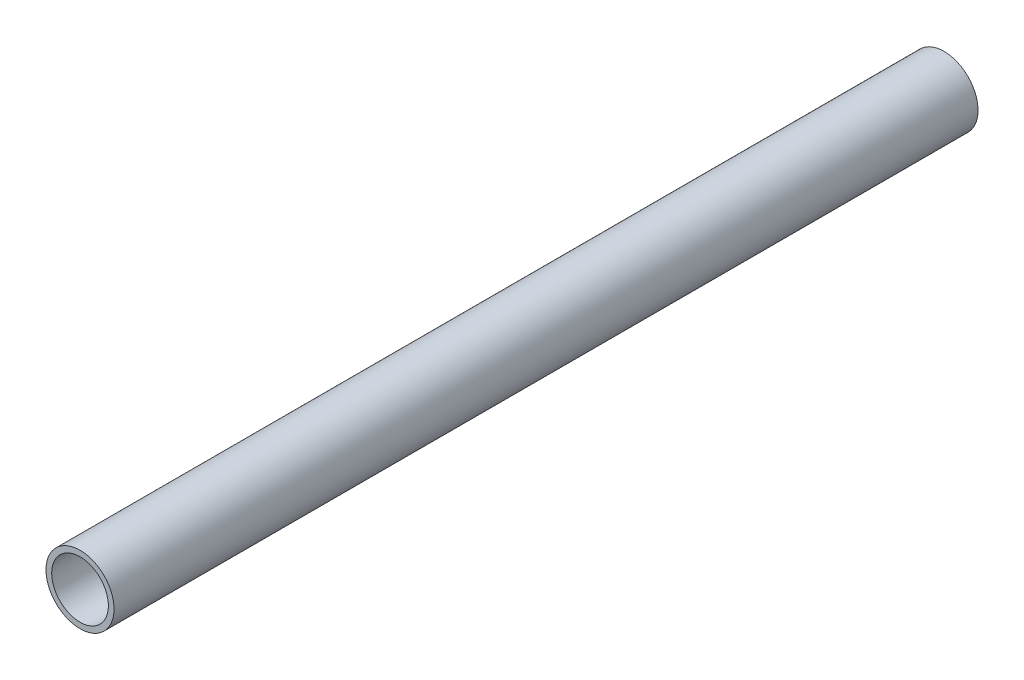
from build123d import *

# Parameters (mm, degrees)
SKETCH1_R           = 3
SKETCH1_R_2         = 2.5
BOSS_EXTRUDE1_DEPTH = 76.2


with BuildPart() as part:
    # Sketch1 → Boss-Extrude1 (new body)
    with BuildSketch(Plane.XY):
        with Locations(Location((0, 0, 0), (0, 0, 180))):
            Circle(SKETCH1_R)
        with Locations(Location((0, 0, 0), (0, 0, 180))):
            Circle(SKETCH1_R_2, mode=Mode.SUBTRACT)
    extrude(amount=BOSS_EXTRUDE1_DEPTH)


solid = part.part
